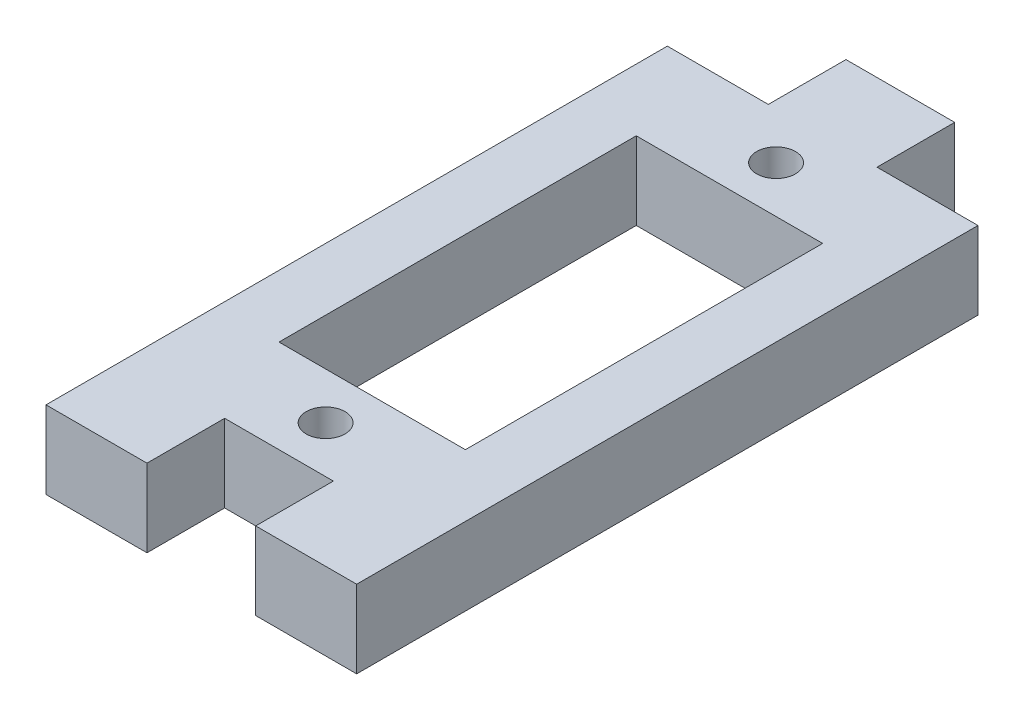
from build123d import *

# Parameters (mm, degrees)
BOSS_EXTRUDE1_DEPTH = 5
SKETCH2_R           = 1.25
SKETCH2_W           = 12
SKETCH2_H           = 23
CUT_EXTRUDE1_DEPTH  = 5


with BuildPart() as part:
    # Sketch1 → Boss-Extrude1 (new body)
    with BuildSketch(Plane(origin=(0, 0, 0), x_dir=(1, 0, 0), z_dir=(0, 1, 0))):
        Polygon((-10, 20), (-10, -20), (-3.5, -20), (-3.5, -15), (3.5, -15), (3.5, -20), (10, -20), (10, 20), (3.5, 20), (3.5, 25), (-3.5, 25), (-3.5, 20), align=None)
    extrude(amount=BOSS_EXTRUDE1_DEPTH)

    # Sketch2 → Cut-Extrude1 (cut)
    with BuildSketch(Plane(origin=(0, 5, 0), x_dir=(1, 0, 0), z_dir=(0, 1, 0))):
        with Locations(Location((0, 17, 0), (0, 0, 270))):
            Circle(SKETCH2_R)
        with Locations(Location((0, -12, 0), (0, 0, 270))):
            Circle(SKETCH2_R)
        with Locations((0, 2.5)):
            Rectangle(SKETCH2_W, SKETCH2_H)
    extrude(amount=-CUT_EXTRUDE1_DEPTH, mode=Mode.SUBTRACT)


solid = part.part
